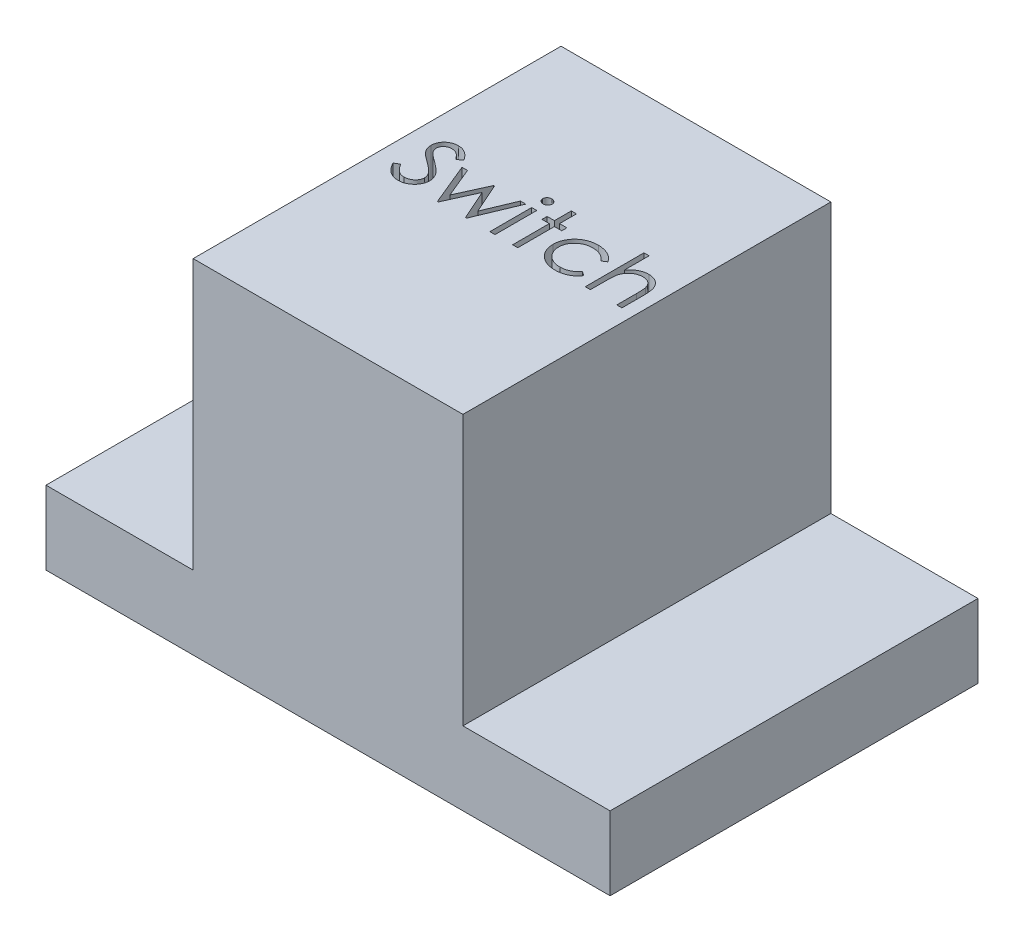
from build123d import *

# Parameters (mm, degrees)
SKETCH1_W           = 73.025
SKETCH1_H           = 47.625
BOSS_EXTRUDE1_DEPTH = 44.45
SKETCH2_W           = 19.05
SKETCH2_H           = 47.625
CUT_EXTRUDE1_DEPTH  = 34.925
SKETCH3_W           = 0.664850428
SKETCH3_H           = 5.413782051
CUT_EXTRUDE2_DEPTH  = 98.860072297


with BuildPart() as part:
    # Sketch1 → Boss-Extrude1 (new body)
    with BuildSketch(Plane(origin=(0, 0, 0), x_dir=(1, 0, 0), z_dir=(0, 1, 0))):
        with Locations((36.5125, 23.8125)):
            Rectangle(SKETCH1_W, SKETCH1_H)
    extrude(amount=BOSS_EXTRUDE1_DEPTH)

    # Sketch2 → Cut-Extrude1 (cut)
    with BuildSketch(Plane(origin=(0, 44.45, 0), x_dir=(1, 0, 0), z_dir=(0, 1, 0))):
        with Locations((9.525, 23.8125)):
            Rectangle(SKETCH2_W, SKETCH2_H)
        with Locations((63.5, 23.8125)):
            Rectangle(SKETCH2_W, SKETCH2_H)
    extrude(amount=-CUT_EXTRUDE1_DEPTH, mode=Mode.SUBTRACT)

    # Sketch3 → Cut-Extrude2 (cut, through all)
    with BuildSketch(Plane(origin=(0, 44.45, 0), x_dir=(1, 0, 0), z_dir=(0, 1, 0))):
        with BuildLine():
            Line((21.271957265, 23.654131611), (21.898222623, 24.029594017))
            add(Edge.make_bspline(
                [(21.898222623, 24.029594017), (21.956469558, 23.932091069), (22.068068439, 23.745279183), (22.254232149, 23.492849664), (22.447130145, 23.278299766), (22.648190901, 23.102877613), (22.856187157, 22.964767469), (23.072476738, 22.866972746), (23.296330771, 22.805978931), (23.448675359, 22.798570415), (23.524731704, 22.794871795)],
                knots=[0, 0, 0, 0, 1.272034388, 2.437168799, 3.508375237, 4.49857839, 5.41946034, 6.295179144, 7.148887113, 8, 8, 8, 8], degree=3))
            add(Edge.make_bspline(
                [(23.524731704, 22.794871795), (23.589685559, 22.796680852), (23.718456728, 22.800267311), (23.908030143, 22.834728342), (24.092141624, 22.887670682), (24.266996574, 22.963491653), (24.430182291, 23.055224781), (24.57328313, 23.16602419), (24.696994069, 23.290073993), (24.798190029, 23.428467278), (24.875829437, 23.577305243), (24.935502648, 23.730077673), (24.968618054, 23.889184476), (24.973606516, 23.996309956), (24.976123932, 24.050370593)],
                knots=[0, 0, 0, 0, 1.095163259, 2.171163733, 3.241058638, 4.321873601, 5.38011039, 6.391990106, 7.366004449, 8.327778327, 9.272591725, 10.192022065, 11.087607919, 12, 12, 12, 12], degree=3))
            add(Edge.make_bspline(
                [(24.976123932, 24.050370593), (24.973003307, 24.112052058), (24.966659534, 24.237441464), (24.913041235, 24.422437396), (24.828693662, 24.605513336), (24.7508794, 24.718757681), (24.710480569, 24.777550748)],
                knots=[0, 0, 0, 0, 0.938893495, 1.908633276, 2.914225137, 4, 4, 4, 4], degree=3))
            add(Edge.make_bspline(
                [(24.710480569, 24.777550748), (24.677311102, 24.819983191), (24.607675956, 24.909064798), (24.487962554, 25.04166388), (24.347487612, 25.178439533), (24.191058421, 25.324614537), (24.012976716, 25.473390374), (23.818820144, 25.631861562), (23.603631643, 25.794001567), (23.452714375, 25.902740164), (23.37484355, 25.958847489)],
                knots=[0, 0, 0, 0, 0.722233717, 1.516239348, 2.393582979, 3.351407094, 4.387010283, 5.505090956, 6.712668013, 8, 8, 8, 8], degree=3))
            add(Edge.make_bspline(
                [(23.37484355, 25.958847489), (23.296899424, 26.014364666), (23.147876192, 26.120509282), (22.939472193, 26.278040683), (22.753111413, 26.422066873), (22.589622161, 26.553943699), (22.449076348, 26.673689046), (22.330366461, 26.780153017), (22.236516516, 26.876214887), (22.18432887, 26.938532394), (22.160897903, 26.966511418)],
                knots=[0, 0, 0, 0, 1.452282411, 2.77665338, 3.964542531, 5.026858415, 5.96415736, 6.766646006, 7.446254459, 8, 8, 8, 8], degree=3))
            add(Edge.make_bspline(
                [(22.160897903, 26.966511418), (22.128147683, 27.010116946), (22.063739978, 27.095873069), (21.978721933, 27.229910685), (21.906460705, 27.36711993), (21.849813769, 27.50786951), (21.802112106, 27.650183443), (21.770027819, 27.79591858), (21.749937696, 27.944420989), (21.747880324, 28.044356232), (21.746850427, 28.094382679)],
                knots=[0, 0, 0, 0, 1.068054152, 2.10047183, 3.106115577, 4.101338837, 5.06977816, 6.043150881, 7.020423561, 8, 8, 8, 8], degree=3))
            add(Edge.make_bspline(
                [(21.746850427, 28.094382679), (21.74961312, 28.172762368), (21.755079454, 28.327846437), (21.801308549, 28.554395028), (21.874276174, 28.770689611), (21.976500353, 28.974588817), (22.108278417, 29.160783477), (22.260775729, 29.331415358), (22.442410042, 29.474858857), (22.641699761, 29.600191047), (22.859835748, 29.698289922), (23.088416494, 29.772290663), (23.327805296, 29.814220259), (23.489948598, 29.820237444), (23.57222102, 29.823290598)],
                knots=[0, 0, 0, 0, 1.005424448, 1.989358655, 2.955360095, 3.929531133, 4.905563448, 5.876582895, 6.856512386, 7.866279853, 8.892233794, 9.918561126, 10.94386622, 12, 12, 12, 12], degree=3))
            add(Edge.make_bspline(
                [(23.57222102, 29.823290598), (23.659521033, 29.820279531), (23.833132894, 29.814291478), (24.088507067, 29.762226704), (24.334380583, 29.676076949), (24.532168827, 29.578310956), (24.686966505, 29.480666126), (24.80501879, 29.391724164), (24.924647394, 29.289330185), (25.046817277, 29.173211447), (25.169458339, 29.042302491), (25.294391313, 28.897499866), (25.421908349, 28.739688489), (25.503941586, 28.627029963), (25.545995726, 28.569275841)],
                knots=[0, 0, 0, 0, 1.286793592, 2.559021753, 3.825965368, 5.121522368, 5.803751409, 6.523245864, 7.299691795, 8.125521123, 9.008227632, 9.944561021, 10.946284179, 12, 12, 12, 12], degree=3))
            Line((25.545995726, 28.569275841), (24.944959068, 28.113675214))
            add(Edge.make_bspline(
                [(24.944959068, 28.113675214), (24.908666844, 28.160429608), (24.838776507, 28.250467641), (24.732669093, 28.376560259), (24.632659455, 28.491741807), (24.534127775, 28.591786328), (24.442277922, 28.682172511), (24.353130182, 28.759557329), (24.267967472, 28.824699006), (24.160616678, 28.894217875), (24.025747508, 28.963129141), (23.856446906, 29.021441356), (23.679522624, 29.056482904), (23.55902157, 29.061116049), (23.498018964, 29.063461538)],
                knots=[0, 0, 0, 0, 1.181633172, 2.275549214, 3.290209073, 4.226197932, 5.078386478, 5.862611352, 6.581680152, 7.217281963, 8.414376989, 9.595101626, 10.782541182, 12, 12, 12, 12], degree=3))
            add(Edge.make_bspline(
                [(23.498018964, 29.063461538), (23.421487658, 29.060896774), (23.273904244, 29.055950866), (23.064374911, 29.001933564), (22.87579277, 28.91688196), (22.713756507, 28.797681923), (22.578846572, 28.656455821), (22.481256685, 28.493940578), (22.422518836, 28.314484493), (22.415351211, 28.18930132), (22.411700855, 28.125547543)],
                knots=[0, 0, 0, 0, 1.14458467, 2.207223713, 3.21896685, 4.227309161, 5.202851033, 6.127160689, 7.046193047, 8, 8, 8, 8], degree=3))
            add(Edge.make_bspline(
                [(22.411700855, 28.125547543), (22.412532973, 28.085856913), (22.41419857, 28.006410752), (22.437428558, 27.889038576), (22.467272138, 27.771962907), (22.514564041, 27.655710107), (22.579853267, 27.538247047), (22.665589223, 27.417551036), (22.7735674, 27.292558252), (22.85628041, 27.211262644), (22.899950387, 27.168341012)],
                knots=[0, 0, 0, 0, 0.858281714, 1.717966888, 2.583508476, 3.4729293, 4.427298488, 5.488583878, 6.674047936, 8, 8, 8, 8], degree=3))
            add(Edge.make_bspline(
                [(22.899950387, 27.168341012), (22.916166959, 27.153869308), (22.954693821, 27.11948785), (23.025127864, 27.063200856), (23.11814012, 26.993768321), (23.231301779, 26.907858501), (23.366699362, 26.80820274), (23.524347755, 26.696075261), (23.702489667, 26.567836039), (23.828901055, 26.478179245), (23.895741987, 26.430772569)],
                knots=[0, 0, 0, 0, 0.420754252, 0.999615792, 1.744751191, 2.668019286, 3.750313428, 4.999500688, 6.413464383, 8, 8, 8, 8], degree=3))
            add(Edge.make_bspline(
                [(23.895741987, 26.430772569), (23.976145504, 26.372265025), (24.13183577, 26.258973274), (24.35336098, 26.088760085), (24.554219541, 25.922288975), (24.735116655, 25.76062304), (24.897839445, 25.604988576), (25.04058262, 25.453513178), (25.164800644, 25.307282049), (25.298529989, 25.119803431), (25.435177374, 24.889550135), (25.552528565, 24.607444531), (25.626523733, 24.324242319), (25.636200108, 24.133897182), (25.640974359, 24.039982305)],
                knots=[0, 0, 0, 0, 1.163667725, 2.253281268, 3.268753668, 4.215851969, 5.092017293, 5.902905408, 6.650798638, 7.335211899, 8.59617414, 9.77448103, 10.901945474, 12, 12, 12, 12], degree=3))
            add(Edge.make_bspline(
                [(25.640974359, 24.039982305), (25.639583417, 23.973564766), (25.636828543, 23.84201947), (25.605161276, 23.648862891), (25.558764651, 23.461260884), (25.488835839, 23.281532362), (25.403485154, 23.106389281), (25.295183263, 22.940425892), (25.169648663, 22.779969015), (25.025643861, 22.629297292), (24.868066701, 22.490981177), (24.701519547, 22.36794133), (24.525729803, 22.265350045), (24.341651099, 22.181634096), (24.149241153, 22.116158151), (23.948564678, 22.068717578), (23.739290879, 22.039601323), (23.59704986, 22.036579228), (23.524731704, 22.035042735)],
                knots=[0, 0, 0, 0, 0.983748083, 1.948392443, 2.894712957, 3.844097841, 4.80183111, 5.778335162, 6.776009319, 7.81870978, 8.863265674, 9.881300176, 10.883814829, 11.87499822, 12.874611388, 13.892143829, 14.928324115, 16, 16, 16, 16], degree=3))
            add(Edge.make_bspline(
                [(23.524731704, 22.035042735), (23.468776895, 22.036124736), (23.357571969, 22.038275111), (23.193086899, 22.057285488), (23.031924769, 22.084182191), (22.876107872, 22.126883972), (22.723628684, 22.178693574), (22.575150371, 22.242486378), (22.430600974, 22.318934454), (22.289170423, 22.406342256), (22.15121842, 22.508064482), (22.01803888, 22.626541716), (21.885262104, 22.758506369), (21.756807115, 22.907542061), (21.630075626, 23.071241003), (21.507566326, 23.251134775), (21.386743357, 23.446243507), (21.31093395, 23.583541272), (21.271957265, 23.654131611)],
                knots=[0, 0, 0, 0, 0.915332311, 1.819136955, 2.706846663, 3.586547465, 4.459518054, 5.340707479, 6.227863349, 7.133153174, 8.059268498, 9.028702269, 10.047606654, 11.120612155, 12.245963614, 13.433783089, 14.680604001, 16, 16, 16, 16], degree=3))
        make_face()
        Polygon((26.210846154, 27.638782051), (26.924669939, 27.638782051), (28.53782265, 23.74465812), (30.305315638, 27.638782051), (30.418102764, 27.638782051), (32.147010684, 23.74465812), (33.775003806, 27.638782051), (34.473987179, 27.638782051), (32.210824452, 22.225), (32.072808627, 22.225), (30.342416667, 26.119123932), (28.576407719, 22.225), (28.453232305, 22.225), align=None)
        with BuildLine():
            add(Edge.make_bspline(
                [(35.563273371, 29.918269231), (35.604529989, 29.916355442), (35.685318372, 29.912607875), (35.802144122, 29.880516081), (35.908521464, 29.826118414), (36.002877665, 29.753136423), (36.083844159, 29.667306767), (36.140529996, 29.567271051), (36.176962901, 29.459196932), (36.181362509, 29.38381166), (36.183602564, 29.345429354)],
                knots=[0, 0, 0, 0, 1.055194115, 2.066272739, 3.074728998, 4.095836921, 5.109056067, 6.073838105, 7.019297344, 8, 8, 8, 8], degree=3))
            add(Edge.make_bspline(
                [(36.183602564, 29.345429354), (36.181311992, 29.308043404), (36.176783803, 29.234135807), (36.140558137, 29.127935291), (36.083361067, 29.029289558), (36.002929584, 28.943626555), (35.908507707, 28.870684909), (35.802147776, 28.816276545), (35.68531741, 28.784187588), (35.604529664, 28.78043963), (35.563273371, 28.778525641)],
                knots=[0, 0, 0, 0, 0.96129708, 1.900370562, 2.859976407, 3.87933698, 4.906634145, 5.921202961, 6.938410037, 8, 8, 8, 8], degree=3))
            add(Edge.make_bspline(
                [(35.563273371, 28.778525641), (35.522488855, 28.780366549), (35.443107124, 28.783949635), (35.328030641, 28.816906173), (35.222560338, 28.870703528), (35.128020114, 28.943148953), (35.049216206, 29.029815652), (34.991858083, 29.127875091), (34.955716081, 29.234151134), (34.951176617, 29.308048553), (34.948880342, 29.345429354)],
                knots=[0, 0, 0, 0, 1.054934014, 2.053291228, 3.073705704, 4.106921865, 5.123545215, 6.088680038, 7.033164197, 8, 8, 8, 8], degree=3))
            add(Edge.make_bspline(
                [(34.948880342, 29.345429354), (34.951126309, 29.383806319), (34.955537529, 29.459181099), (34.991885175, 29.567332252), (35.048738434, 29.666776431), (35.128072294, 29.753613738), (35.222546451, 29.826099909), (35.328034229, 29.879886486), (35.443106176, 29.912845821), (35.522488533, 29.916428521), (35.563273371, 29.918269231)],
                knots=[0, 0, 0, 0, 0.98631895, 1.937192651, 2.907499808, 3.917963147, 4.944918757, 5.95915025, 6.951458133, 8, 8, 8, 8], degree=3))
        make_face()
        with Locations((35.566241453, 24.931891026)):
            Rectangle(SKETCH3_W, SKETCH3_H)
        Polygon((38.178153846, 29.823290598), (38.843004274, 29.823290598), (38.843004274, 27.638782051), (39.792790598, 27.638782051), (39.792790598, 26.973931624), (38.843004274, 26.973931624), (38.843004274, 22.225), (38.178153846, 22.225), (38.178153846, 26.973931624), (37.228367521, 26.973931624), (37.228367521, 27.638782051), (38.178153846, 27.638782051), align=None)
        with BuildLine():
            Line((46.251337607, 26.464905515), (45.694822182, 26.119123932))
            add(Edge.make_bspline(
                [(45.694822182, 26.119123932), (45.633798967, 26.194960699), (45.513685129, 26.344232499), (45.305110412, 26.536870191), (45.082836252, 26.702323763), (44.843064384, 26.837163369), (44.586131107, 26.941348772), (44.313049672, 27.015072707), (44.02385902, 27.061013354), (43.825601016, 27.066234826), (43.724015558, 27.068910256)],
                knots=[0, 0, 0, 0, 1.026593902, 2.0206758, 2.988051866, 3.946915611, 4.916868779, 5.907761954, 6.927957743, 8, 8, 8, 8], degree=3))
            add(Edge.make_bspline(
                [(43.724015558, 27.068910256), (43.642822433, 27.066673274), (43.48291478, 27.062267597), (43.248163422, 27.03472872), (43.024553774, 26.984686469), (42.810684274, 26.918750277), (42.608076055, 26.83037883), (42.416198277, 26.722831513), (42.23334899, 26.597842261), (42.064826887, 26.45303994), (41.910672156, 26.29556276), (41.777112788, 26.126750771), (41.660829613, 25.951660335), (41.569588672, 25.765919147), (41.494922894, 25.573776501), (41.445802003, 25.371605507), (41.413068398, 25.161996224), (41.409323319, 25.019082405), (41.40742735, 24.946731437)],
                knots=[0, 0, 0, 0, 1.112346261, 2.190735716, 3.231507886, 4.247384806, 5.251966152, 6.253067467, 7.256802811, 8.280671706, 9.291813951, 10.270744147, 11.225547591, 12.165006084, 13.100104208, 14.043489273, 15.009504848, 16, 16, 16, 16], degree=3))
            add(Edge.make_bspline(
                [(41.40742735, 24.946731437), (41.411193434, 24.85196994), (41.418674857, 24.663723776), (41.477309614, 24.385851794), (41.573288609, 24.117196649), (41.704644393, 23.859665759), (41.870754328, 23.621341464), (42.06585292, 23.407593152), (42.290048313, 23.222562559), (42.541365079, 23.069162381), (42.813902303, 22.945842486), (43.104711358, 22.857985298), (43.411415893, 22.804957776), (43.621403508, 22.798277697), (43.728467682, 22.794871795)],
                knots=[0, 0, 0, 0, 0.966302908, 1.919585723, 2.883856336, 3.870342332, 4.860282998, 5.839159637, 6.814385684, 7.815993281, 8.834850808, 9.858348828, 10.908058873, 12, 12, 12, 12], degree=3))
            add(Edge.make_bspline(
                [(43.728467682, 22.794871795), (43.826586155, 22.797622397), (44.019414993, 22.803028061), (44.301285747, 22.8485977), (44.569636558, 22.923196724), (44.824457889, 23.027225917), (45.065284107, 23.161692492), (45.290559194, 23.327552737), (45.50476573, 23.520035208), (45.630700997, 23.668874914), (45.694822182, 23.74465812)],
                knots=[0, 0, 0, 0, 1.039848629, 2.043578496, 3.018386758, 3.987534228, 4.954977003, 5.934852016, 6.948509513, 8, 8, 8, 8], degree=3))
            Line((45.694822182, 23.74465812), (46.251337607, 23.379584001))
            add(Edge.make_bspline(
                [(46.251337607, 23.379584001), (46.218343637, 23.331131962), (46.152465209, 23.234388704), (46.042340068, 23.09798199), (45.923553091, 22.970301096), (45.796567703, 22.85151717), (45.663041999, 22.738787696), (45.51841459, 22.637501863), (45.367348912, 22.541966489), (45.208071529, 22.456002576), (45.042229218, 22.378730862), (44.87005534, 22.312286217), (44.69229807, 22.255199493), (44.508748407, 22.209823776), (44.319044489, 22.173605834), (44.123676929, 22.149573832), (43.922713015, 22.131634487), (43.786881961, 22.130563736), (43.718079394, 22.130021368)],
                knots=[0, 0, 0, 0, 0.954134338, 1.905101784, 2.851144739, 3.791306361, 4.734911809, 5.6936923, 6.663572882, 7.643865596, 8.638447847, 9.640600242, 10.646758161, 11.676244097, 12.717260333, 13.78922464, 14.880174919, 16, 16, 16, 16], degree=3))
            add(Edge.make_bspline(
                [(43.718079394, 22.130021368), (43.61306969, 22.13190791), (43.407249908, 22.135605546), (43.106000601, 22.176263486), (42.818105005, 22.237557107), (42.543661481, 22.325533677), (42.282627301, 22.438785451), (42.035245868, 22.577124254), (41.802336296, 22.741698876), (41.586201806, 22.929580071), (41.387697745, 23.133289428), (41.217250642, 23.353105087), (41.069411486, 23.580945305), (40.950692853, 23.821842135), (40.856190192, 24.072593841), (40.79162163, 24.335209182), (40.749860351, 24.60752312), (40.745027198, 24.793224387), (40.742576923, 24.887369792)],
                knots=[0, 0, 0, 0, 1.1129367, 2.181364009, 3.217532258, 4.231199276, 5.232079859, 6.230262199, 7.231623845, 8.250719726, 9.263571943, 10.242672461, 11.195837495, 12.138959767, 13.085126421, 14.0317438, 15.002148558, 16, 16, 16, 16], degree=3))
            add(Edge.make_bspline(
                [(40.742576923, 24.887369792), (40.743510407, 24.951247478), (40.745367261, 25.07831074), (40.766665008, 25.266895297), (40.794178443, 25.452968385), (40.840799586, 25.634171391), (40.894648923, 25.813252588), (40.963388799, 25.988053486), (41.044024051, 26.159386377), (41.135574007, 26.326809905), (41.23863185, 26.487569763), (41.352680461, 26.639448353), (41.473424306, 26.78427019), (41.606512076, 26.917035484), (41.74629601, 27.043053755), (41.896730845, 27.158958452), (42.056953731, 27.265090216), (42.224558431, 27.363411532), (42.399447403, 27.45095567), (42.580563522, 27.526379356), (42.766815434, 27.590837309), (42.958501073, 27.641867854), (43.154348139, 27.684661401), (43.355899971, 27.711580842), (43.562385508, 27.730601786), (43.70220409, 27.732698963), (43.772988916, 27.733760684)],
                knots=[0, 0, 0, 0, 0.990994727, 1.971252077, 2.943264845, 3.907940874, 4.872158414, 5.844625996, 6.82015047, 7.809835459, 8.804511986, 9.781214284, 10.756496977, 11.728388426, 12.696359165, 13.676225489, 14.672885716, 15.677705647, 16.690706858, 17.706033469, 18.721040654, 19.747369689, 20.783475414, 21.830280724, 22.901553713, 24, 24, 24, 24], degree=3))
            add(Edge.make_bspline(
                [(43.772988916, 27.733760684), (43.861635144, 27.731809348), (44.038484506, 27.727916429), (44.300825669, 27.695153282), (44.559302829, 27.645757867), (44.809380865, 27.572578711), (45.048027654, 27.483967306), (45.271411023, 27.384457061), (45.474272576, 27.268898484), (45.660385973, 27.142490908), (45.830099285, 26.999910324), (45.985154628, 26.839452265), (46.128731619, 26.661951817), (46.210131658, 26.531129686), (46.251337607, 26.464905515)],
                knots=[0, 0, 0, 0, 1.095225653, 2.184976855, 3.262915854, 4.344593502, 5.400796181, 6.407717688, 7.363229445, 8.282371371, 9.184954523, 10.097238608, 11.036792983, 12, 12, 12, 12], degree=3))
        make_face()
        with BuildLine():
            Line((47.581038462, 29.823290598), (48.245888889, 29.823290598))
            Line((48.245888889, 29.823290598), (48.245888889, 26.616277711))
            add(Edge.make_bspline(
                [(48.245888889, 26.616277711), (48.317257177, 26.705482473), (48.456214892, 26.879168716), (48.690098339, 27.10578157), (48.930278352, 27.302205318), (49.185050532, 27.458564453), (49.4497408, 27.582085803), (49.725465514, 27.669689654), (50.012275904, 27.723561142), (50.207062471, 27.730331127), (50.305737981, 27.733760684)],
                knots=[0, 0, 0, 0, 1.125788106, 2.19196713, 3.20547328, 4.180437432, 5.132270164, 6.079753143, 7.027236121, 8, 8, 8, 8], degree=3))
            add(Edge.make_bspline(
                [(50.305737981, 27.733760684), (50.405920646, 27.73006619), (50.602002286, 27.722835174), (50.887501382, 27.66565685), (51.154118567, 27.56795694), (51.401061268, 27.434253404), (51.62294021, 27.267729253), (51.819472211, 27.075469196), (51.980001902, 26.852639403), (52.089220033, 26.646780332), (52.160283746, 26.463606636), (52.205266778, 26.306472685), (52.243407415, 26.131377969), (52.276638522, 25.938412619), (52.298786437, 25.726650339), (52.316576211, 25.497046501), (52.329226373, 25.249614267), (52.329716602, 25.078333073), (52.329970085, 24.98976863)],
                knots=[0, 0, 0, 0, 1.235656852, 2.418478516, 3.575258207, 4.727955599, 5.870717718, 6.98870536, 8.107142894, 9.245821548, 9.854588956, 10.528768408, 11.260415777, 12.065282286, 12.943670737, 13.886611085, 14.907229059, 16, 16, 16, 16], degree=3))
            Line((52.329970085, 24.98976863), (52.329970085, 22.225))
            Line((52.329970085, 22.225), (51.665119658, 22.225))
            Line((51.665119658, 22.225), (51.665119658, 24.771614583))
            add(Edge.make_bspline(
                [(51.665119658, 24.771614583), (51.66471685, 24.845322567), (51.663946346, 24.986313396), (51.661399267, 25.188171659), (51.655713444, 25.371255144), (51.646525363, 25.534977091), (51.636862129, 25.679565752), (51.623562441, 25.80481115), (51.608089112, 25.910885308), (51.594185191, 25.974733772), (51.587949519, 26.003368723)],
                knots=[0, 0, 0, 0, 1.430932559, 2.737130458, 3.918967929, 4.986496826, 5.920444988, 6.731744033, 7.431208747, 8, 8, 8, 8], degree=3))
            add(Edge.make_bspline(
                [(51.587949519, 26.003368723), (51.5637682, 26.087388248), (51.517279756, 26.248915295), (51.409228204, 26.468334063), (51.274271631, 26.655415098), (51.109494927, 26.807633674), (50.917813056, 26.927038099), (50.697976132, 27.009731571), (50.452053188, 27.061055916), (50.278800906, 27.066219109), (50.188498731, 27.068910256)],
                knots=[0, 0, 0, 0, 1.090059168, 2.095632401, 3.037101401, 3.955032261, 4.878929692, 5.839099886, 6.873700383, 8, 8, 8, 8], degree=3))
            add(Edge.make_bspline(
                [(50.188498731, 27.068910256), (50.135015278, 27.067903091), (50.029172906, 27.065909936), (49.872224897, 27.045899184), (49.719975046, 27.013199396), (49.570957102, 26.968951456), (49.428329334, 26.908741737), (49.287934379, 26.839039503), (49.153749971, 26.753720363), (49.023393325, 26.657992489), (48.902071213, 26.552011497), (48.789195485, 26.440152109), (48.688572665, 26.321036768), (48.597410814, 26.196576523), (48.518716776, 26.065064227), (48.450024419, 25.927768086), (48.391740528, 25.784507544), (48.36277883, 25.685076997), (48.348287727, 25.635326522)],
                knots=[0, 0, 0, 0, 1.024319606, 2.027102035, 3.025350316, 4.005802111, 5.00026367, 5.987881639, 7.005602596, 8.042517216, 9.083927026, 10.089214625, 11.084353441, 12.06828073, 13.041928858, 14.016821737, 15.00770877, 16, 16, 16, 16], degree=3))
            add(Edge.make_bspline(
                [(48.348287727, 25.635326522), (48.339949273, 25.599298843), (48.321778754, 25.520790095), (48.302062357, 25.391304443), (48.284414021, 25.240838289), (48.269494591, 25.069619851), (48.260344058, 24.877021722), (48.250484115, 24.664358192), (48.246813785, 24.430297148), (48.246206402, 24.26753499), (48.245888889, 24.182450254)],
                knots=[0, 0, 0, 0, 0.607992626, 1.324890765, 2.152360218, 3.099583803, 4.150613268, 5.323148443, 6.60066238, 8, 8, 8, 8], degree=3))
            Line((48.245888889, 24.182450254), (48.245888889, 22.225))
            Line((48.245888889, 22.225), (47.581038462, 22.225))
            Line((47.581038462, 22.225), (47.581038462, 29.823290598))
        make_face()
    extrude(amount=-CUT_EXTRUDE2_DEPTH, mode=Mode.SUBTRACT)


solid = part.part
